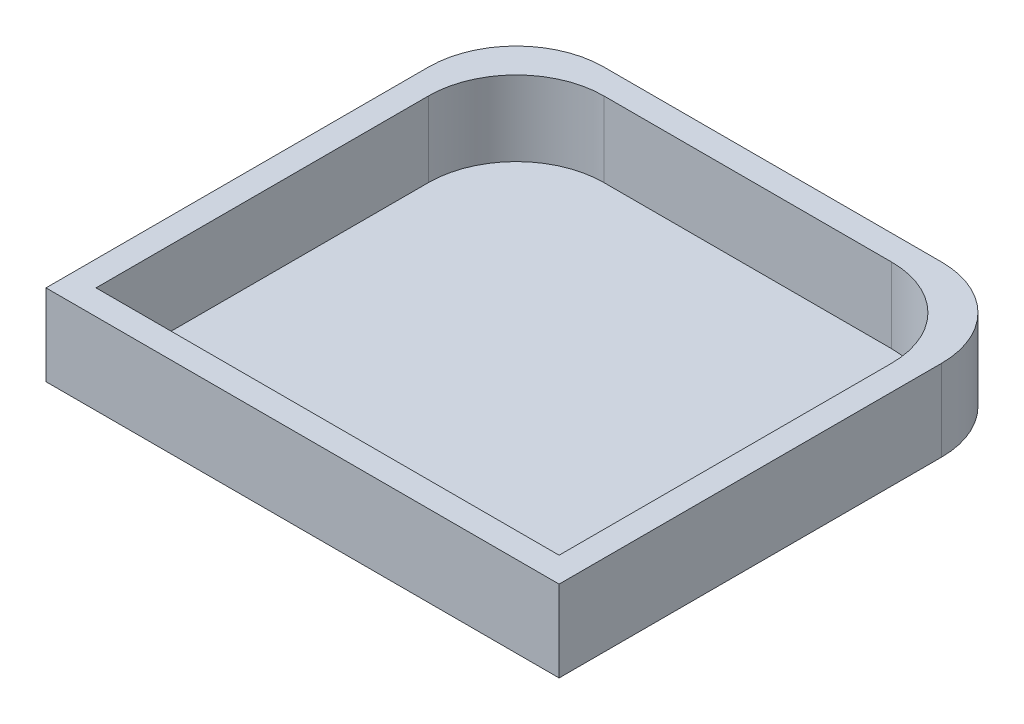
from build123d import *

# Parameters (mm, degrees)
BOSS_EXTRUDE1_DEPTH = 13
CUT_EXTRUDE1_DEPTH  = 12


with BuildPart() as part:
    # Sketch3 → Boss-Extrude1 (new body)
    with BuildSketch(Plane(origin=(0, 0, 0), x_dir=(1, 0, 0), z_dir=(0, 1, 0))):
        with BuildLine():
            Line((-41.015, -37.585), (41.015, -37.585))
            Line((41.015, -37.585), (41.015, 23.585))
            ThreePointArc((41.015, 23.585), (36.914494937, 33.484494937), (27.015, 37.585))
            Line((27.015, 37.585), (-27.015, 37.585))
            ThreePointArc((-27.015, 37.585), (-36.914494937, 33.484494937), (-41.015, 23.585))
            Line((-41.015, 23.585), (-41.015, -37.585))
        make_face()
    extrude(amount=BOSS_EXTRUDE1_DEPTH)

    # Sketch4 → Cut-Extrude1 (cut)
    with BuildSketch(Plane(origin=(0, 13, 0), x_dir=(1, 0, 0), z_dir=(0, 1, 0))):
        with BuildLine():
            Line((-37.015, -33.585), (37.015, -33.585))
            Line((37.015, -33.585), (37.015, 19.585))
            ThreePointArc((37.015, 19.585), (32.914494937, 29.484494937), (23.015, 33.585))
            Line((23.015, 33.585), (-23.015, 33.585))
            ThreePointArc((-23.015, 33.585), (-32.914494937, 29.484494937), (-37.015, 19.585))
            Line((-37.015, 19.585), (-37.015, -33.585))
        make_face()
    extrude(amount=-CUT_EXTRUDE1_DEPTH, mode=Mode.SUBTRACT)


solid = part.part
